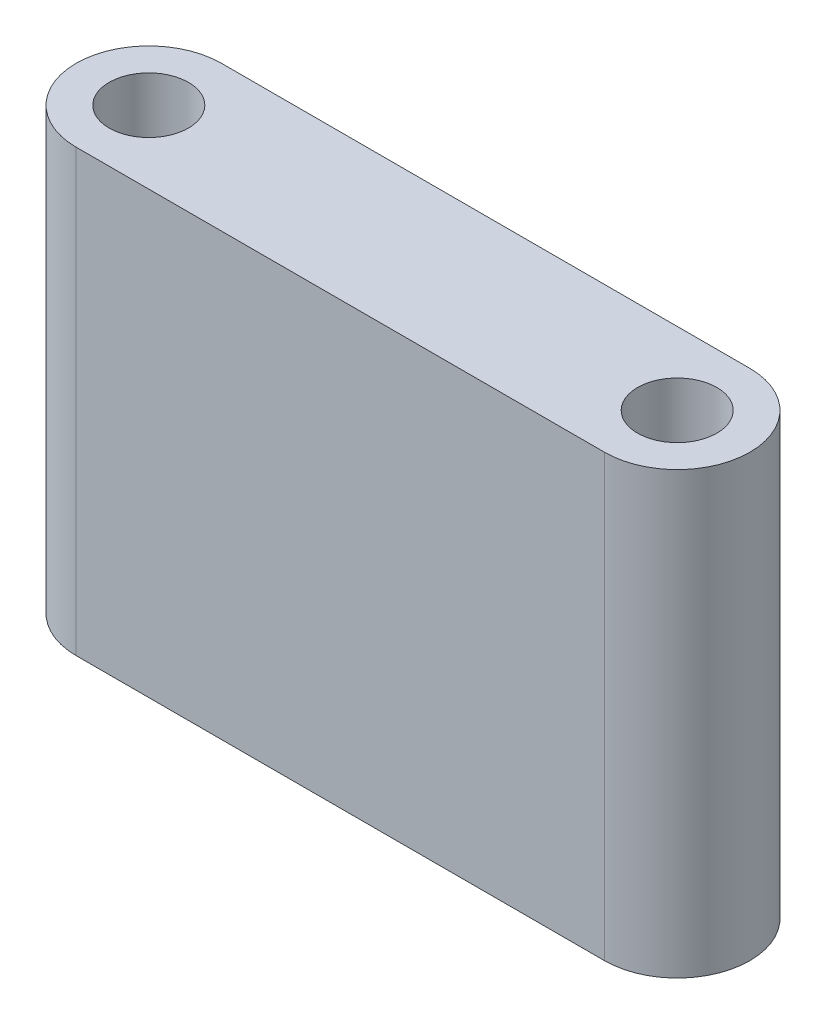
from build123d import *

# Parameters (mm, degrees)
SKETCH1_R           = 1.8
BOSS_EXTRUDE1_DEPTH = 20


with BuildPart() as part:
    # Sketch1 → Boss-Extrude1 (new body)
    with BuildSketch(Plane(origin=(0, 0, 0), x_dir=(1, 0, 0), z_dir=(0, 1, 0))):
        with BuildLine():
            Line((0, 3.3), (24, 3.3))
            ThreePointArc((24, 3.3), (27.3, 0), (24, -3.3))
            Line((24, -3.3), (0, -3.3))
            ThreePointArc((0, -3.3), (-3.3, 0), (0, 3.3))
        make_face()
        with Locations(Location((0, 0, 0), (0, 0, 270))):
            Circle(SKETCH1_R, mode=Mode.SUBTRACT)
        with Locations(Location((24, 0, 0), (0, 0, 90))):
            Circle(SKETCH1_R, mode=Mode.SUBTRACT)
    extrude(amount=BOSS_EXTRUDE1_DEPTH)


solid = part.part
